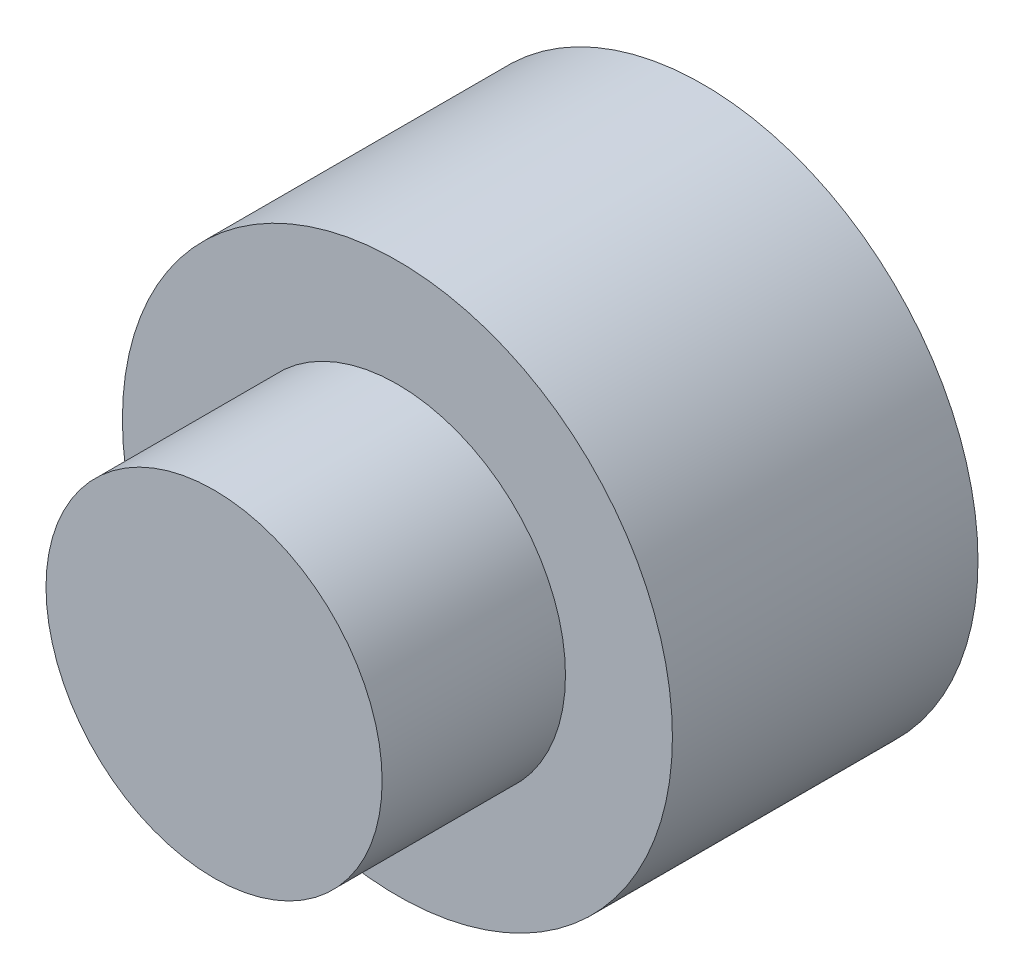
from build123d import *


with BuildPart() as part:
    # Sketch1 → Revolve1 (revolve)
    with BuildSketch(Plane(origin=(0, 0, 0), x_dir=(1, 0, 0), z_dir=(0, 1, 0))):
        Polygon((-4.5, 0.318965517), (-4.5, -4.681034483), (-2.75, -4.681034483), (-2.75, -7.681034483), (0, -7.681034483), (0, 0.318965517), align=None)
    revolve(axis=Axis((0, 0, -18.017241379), (0, 0, 1)))


solid = part.part
